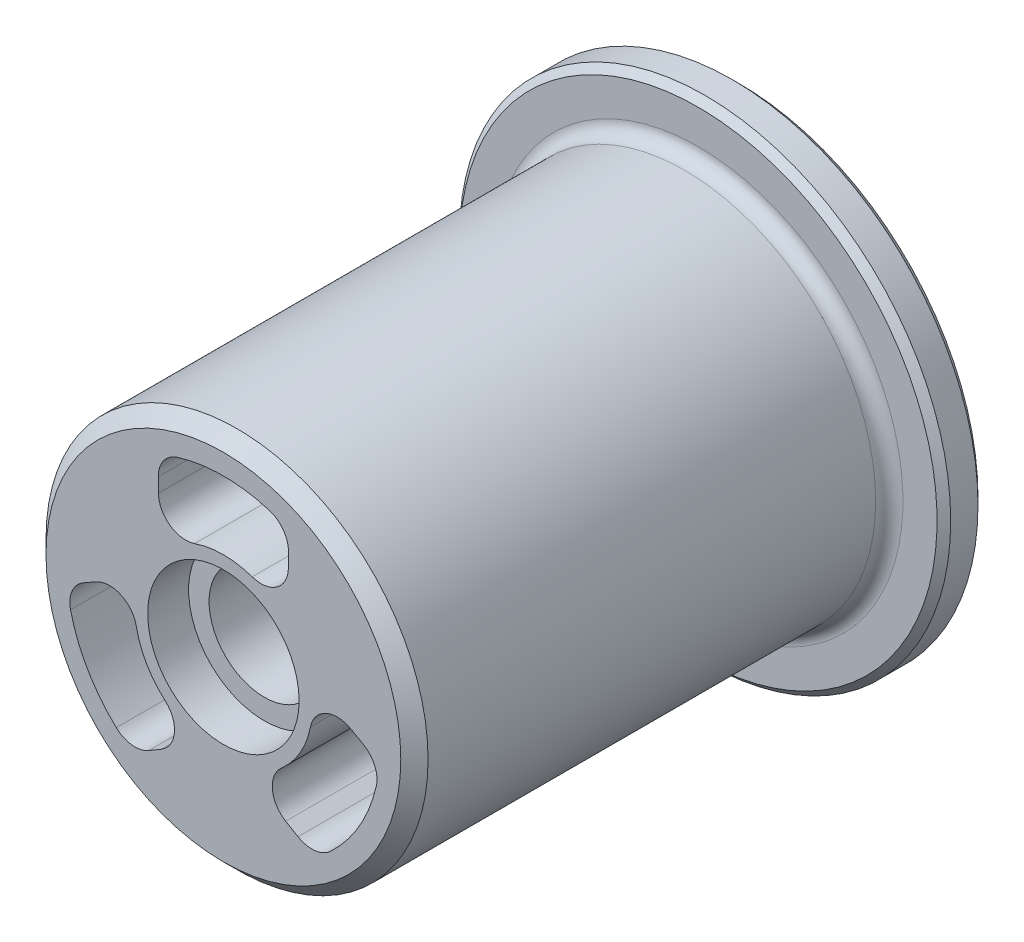
from build123d import *

# Parameters (mm, degrees)
CROQUIS1_R              = 14
CROQUIS1_R_2            = 4.05
SALIENTE_EXTRUIR1_DEPTH = 18.9
CHAFL_N1_SIZE           = 1
CORTAR_EXTRUIR1_REACH   = 44.671
REDONDEO1_R             = 2
MATRIZC1_COUNT          = 3
REDONDEO1_OF_MATRIZC1_R = 2
CROQUIS3_R              = 4
CORTAR_EXTRUIR2_DEPTH   = 29
SALIENTE_EXTRUIR2_START = -3
CROQUIS6_R              = 18
CROQUIS6_R_2            = 4.05
SALIENTE_EXTRUIR2_DEPTH = 3
CHAFL_N2_SIZE           = 0.5
REDONDEO2_R             = 1
CROQUIS12_R             = 5.55
CORTAR_EXTRUIR4_DEPTH   = 3


with BuildPart() as part:
    # Croquis1 → Saliente-Extruir1 (new, symmetric)
    with BuildSketch(Plane(origin=(0, 0, 0), x_dir=(0, 1, 0), z_dir=(0, 0, 1))):
        with Locations(Location((0, 0, 0), (0, 0, 270))):
            Circle(CROQUIS1_R)
        with Locations(Location((0, 0, 0), (0, 0, 270))):
            Circle(CROQUIS1_R_2, mode=Mode.SUBTRACT)
    extrude(amount=SALIENTE_EXTRUIR1_DEPTH, both=True)

    # Chaflán1
    chafl_n1_edges = [part.edges().sort_by_distance(p)[0] for p in [
        (-14, 0, 18.9),
    ]]
    chamfer(chafl_n1_edges, length=CHAFL_N1_SIZE)

    # Croquis2 → Cortar-Extruir1 (cut, up to next)
    with BuildSketch(Plane.XY.offset(18.9), mode=Mode.PRIVATE) as cortar_extruir1_sk1:
        with BuildLine():
            Line((4.729506573, 4.458897574), (4.781865786, 10.458669113))
            ThreePointArc((4.781865786, 10.458669113), (0, 11.5), (-4.781865786, 10.458669113))
            Line((-4.781865786, 10.458669113), (-4.729506573, 4.458897574))
            ThreePointArc((-4.729506573, 4.458897574), (0, 6.5), (4.729506573, 4.458897574))
        make_face()
    cortar_extruir1_tool1 = extrude(cortar_extruir1_sk1.sketch, amount=-CORTAR_EXTRUIR1_REACH, mode=Mode.PRIVATE) & part.part
    cortar_extruir1 = cortar_extruir1_tool1.solids().sort_by_distance((0, 8.49359, 18.9))[0]
    add(cortar_extruir1, mode=Mode.SUBTRACT)

    # Redondeo1
    redondeo1_edges = [part.edges().sort_by_distance(p)[0] for p in [
        (4.729506573, 4.458897574, 0),
        (-4.729506573, 4.458897574, 0),
        (-4.781865786, 10.458669113, 0),
        (4.781865786, 10.458669113, 0),
    ]]
    fillet(redondeo1_edges, radius=REDONDEO1_R)

    # MatrizC1: Cortar-Extruir1 ×3 about axis
    matrizc1_axis = Axis((0, 0, 0), (0, 0, 1))
    for i in range(1, MATRIZC1_COUNT):
        add(cortar_extruir1.rotate(matrizc1_axis, i * 360 / MATRIZC1_COUNT), mode=Mode.SUBTRACT)

    # Redondeo1 of MatrizC1
    redondeo1_of_matrizc1_edges = [part.edges().sort_by_distance(p)[0] for p in [
        (-6.226271859, 1.866424052, 0),
        (-1.496765286, -6.325321627, 0),
        (-6.666540248, -9.370551804, 0),
        (-11.448406034, -1.088117308, 0),
        (1.496765286, -6.325321627, 0),
        (6.226271859, 1.866424052, 0),
        (11.448406034, -1.088117308, 0),
        (6.666540248, -9.370551804, 0),
    ]]
    fillet(redondeo1_of_matrizc1_edges, radius=REDONDEO1_OF_MATRIZC1_R)

    # Croquis3 → Cortar-Extruir2 (cut)
    with BuildSketch(Plane(origin=(0, 0, 0), x_dir=(-1, 0, 0), z_dir=(0, 1, 0))):
        with Locations(Location((0, -0.4, 0), (0, 0, 90))):
            Circle(CROQUIS3_R)
    extrude(amount=-CORTAR_EXTRUIR2_DEPTH, mode=Mode.SUBTRACT)

    # Croquis6 → Saliente-Extruir2 (add)
    with BuildSketch(Plane(origin=(0, 0, -18.9), x_dir=(1, 0, 0), z_dir=(0, 0, -1)).offset(SALIENTE_EXTRUIR2_START)):
        with Locations(Location((0, 0, 0), (0, 0, 180))):
            Circle(CROQUIS6_R)
        Circle(CROQUIS6_R_2, mode=Mode.SUBTRACT)
        with BuildLine():
            Line((-10.239546073, 0.40417725), (-9.32733269, -0.111928251))
            ThreePointArc((-9.32733269, -0.111928251), (-7.50591795, -0.187849628), (-6.379547789, 1.245540049))
            ThreePointArc((-6.379547789, 1.245540049), (-5.629165125, 3.25), (-4.268443218, 4.902080425))
            ThreePointArc((-4.268443218, 4.902080425), (-3.590276425, 6.594240438), (-4.566733636, 8.133671184))
            Line((-4.566733636, 8.133671184), (-5.469800803, 8.665618398))
            ThreePointArc((-5.469800803, 8.665618398), (-6.703454741, 8.930380198), (-7.850114903, 8.403909567))
            ThreePointArc((-7.850114903, 8.403909567), (-9.959292144, 5.75), (-11.203056628, 2.596444145))
            ThreePointArc((-11.203056628, 2.596444145), (-11.085663488, 1.340172), (-10.239546073, 0.40417725))
        make_face(mode=Mode.SUBTRACT)
        with BuildLine():
            Line((5.469800803, 8.665618398), (4.566733636, 8.133671184))
            ThreePointArc((4.566733636, 8.133671184), (3.590276425, 6.594240438), (4.268443218, 4.902080425))
            ThreePointArc((4.268443218, 4.902080425), (5.629165125, 3.25), (6.379547789, 1.245540049))
            ThreePointArc((6.379547789, 1.245540049), (7.50591795, -0.187849628), (9.32733269, -0.111928251))
            Line((9.32733269, -0.111928251), (10.239546073, 0.40417725))
            ThreePointArc((10.239546073, 0.40417725), (11.085663488, 1.340172), (11.203056628, 2.596444145))
            ThreePointArc((11.203056628, 2.596444145), (9.959292144, 5.75), (7.850114903, 8.403909567))
            ThreePointArc((7.850114903, 8.403909567), (6.703454741, 8.930380198), (5.469800803, 8.665618398))
        make_face(mode=Mode.SUBTRACT)
        with BuildLine():
            Line((-4.760599053, -8.021742934), (-4.769745271, -9.069795648))
            ThreePointArc((-4.769745271, -9.069795648), (-4.382208746, -10.270552198), (-3.352941725, -11.000353712))
            ThreePointArc((-3.352941725, -11.000353712), (0, -11.5), (3.352941725, -11.000353712))
            ThreePointArc((3.352941725, -11.000353712), (4.382208746, -10.270552198), (4.769745271, -9.069795648))
            Line((4.769745271, -9.069795648), (4.760599053, -8.021742934))
            ThreePointArc((4.760599053, -8.021742934), (3.915641525, -6.40639081), (2.11110457, -6.147620474))
            ThreePointArc((2.11110457, -6.147620474), (0, -6.5), (-2.11110457, -6.147620474))
            ThreePointArc((-2.11110457, -6.147620474), (-3.915641525, -6.40639081), (-4.760599053, -8.021742934))
        make_face(mode=Mode.SUBTRACT)
    extrude(amount=SALIENTE_EXTRUIR2_DEPTH)

    # Chaflán2
    chafl_n2_edges = [part.edges().sort_by_distance(p)[0] for p in [
        (18, 0, -18.9),
        (18, 0, -15.9),
    ]]
    chamfer(chafl_n2_edges, length=CHAFL_N2_SIZE)

    # Redondeo2
    redondeo2_edges = [part.edges().sort_by_distance(p)[0] for p in [
        (-14, 0, -15.9),
    ]]
    fillet(redondeo2_edges, radius=REDONDEO2_R)

    # Croquis12 → Cortar-Extruir4 (cut)
    with BuildSketch(Plane.XY.offset(18.9)):
        Circle(CROQUIS12_R)
    extrude(amount=-CORTAR_EXTRUIR4_DEPTH, mode=Mode.SUBTRACT)


solid = part.part
